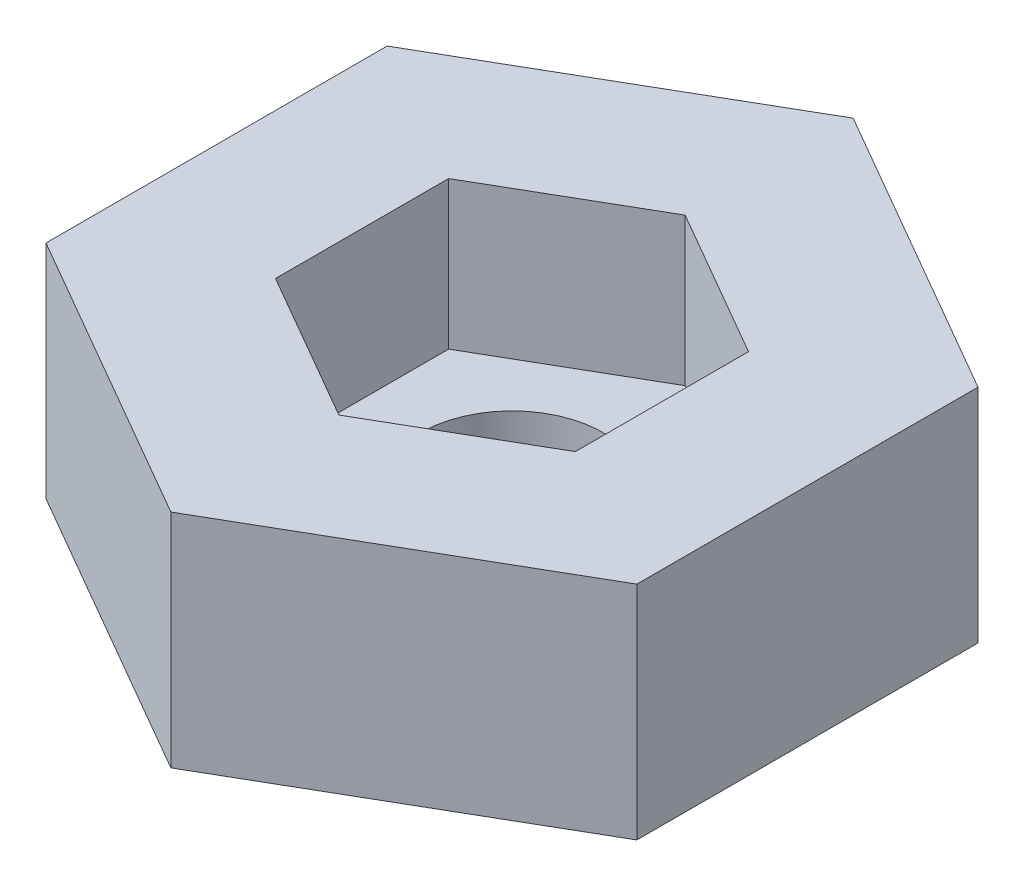
from build123d import *

# Parameters (mm, degrees)
SKETCH1_R           = 3.1
BOSS_EXTRUDE1_DEPTH = 3.75
CUT_EXTRUDE1_DEPTH  = 5


with BuildPart() as part:
    # Sketch1 → Boss-Extrude1 (new, symmetric)
    with BuildSketch(Plane(origin=(0, 0, 0), x_dir=(1, 0, 0), z_dir=(0, 1, 0))):
        Polygon((0, -11.547005384), (10, -5.773502692), (10, 5.773502692), (0, 11.547005384), (-10, 5.773502692), (-10, -5.773502692), align=None)
        with Locations(Location((0, 0, 0), (0, 0, 270))):
            Circle(SKETCH1_R, mode=Mode.SUBTRACT)
    extrude(amount=BOSS_EXTRUDE1_DEPTH, both=True)

    # Sketch2 → Cut-Extrude1 (cut)
    with BuildSketch(Plane(origin=(0, 3.75, 0), x_dir=(1, 0, 0), z_dir=(0, 1, 0))):
        Polygon((0, 5.860105232), (-5.075, 2.930052616), (-5.075, -2.930052616), (0, -5.860105232), (5.075, -2.930052616), (5.075, 2.930052616), align=None)
    extrude(amount=-CUT_EXTRUDE1_DEPTH, mode=Mode.SUBTRACT)


solid = part.part
